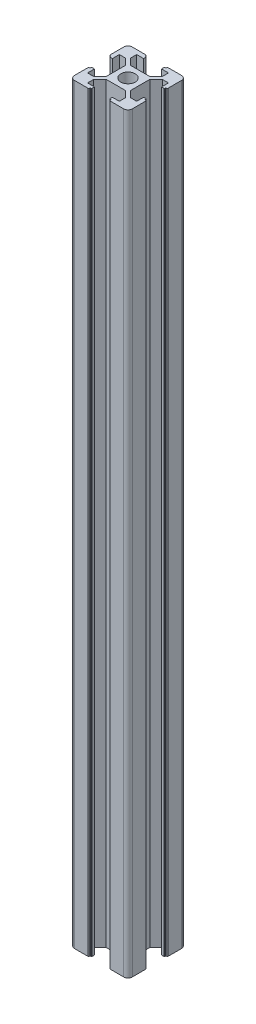
from build123d import *

# Parameters (mm, degrees)
BOSS_EXTRUDE1_DEPTH = 260
SKETCH3_R           = 2.5
CUT_EXTRUDE1_DEPTH  = 261.384331326
CIRPATTERN1_COUNT   = 4


with BuildPart() as part:
    # Sketch2 → Boss-Extrude1 (new body)
    with BuildSketch(Plane(origin=(0, 0, 0), x_dir=(1, 0, 0), z_dir=(0, 1, 0))):
        with BuildLine():
            Line((-10, -8.5), (-10, 8.5))
            ThreePointArc((-10, 8.5), (-9.560660172, 9.560660172), (-8.5, 10))
            Line((-8.5, 10), (8.5, 10))
            ThreePointArc((8.5, 10), (9.560660172, 9.560660172), (10, 8.5))
            Line((10, 8.5), (10, -8.5))
            ThreePointArc((10, -8.5), (9.560660172, -9.560660172), (8.5, -10))
            Line((8.5, -10), (-8.5, -10))
            ThreePointArc((-8.5, -10), (-9.560660172, -9.560660172), (-10, -8.5))
        make_face()
    extrude(amount=BOSS_EXTRUDE1_DEPTH)

    # Sketch3 → Cut-Extrude1 (cut, through all)
    with BuildSketch(Plane(origin=(0, 260, 0), x_dir=(1, 0, 0), z_dir=(0, 1, 0))):
        with BuildLine():
            Line((-6.348528137, -5.5), (-4.2, -3.351471863))
            Line((-4.2, -3.351471863), (-4.2, 3.351471863))
            Line((-4.2, 3.351471863), (-6.348528137, 5.5))
            Line((-6.348528137, 5.5), (-8.5, 5.5))
            Line((-8.5, 5.5), (-8.5, 3.1))
            Line((-8.5, 3.1), (-9.3, 3.1))
            ThreePointArc((-9.3, 3.1), (-9.441421356, 3.158578644), (-9.5, 3.3))
            Line((-9.5, 3.3), (-9.5, 3.6))
            Line((-9.5, 3.6), (-9.8, 3.6))
            ThreePointArc((-9.8, 3.6), (-9.941421356, 3.658578644), (-10, 3.8))
            Line((-10, 3.8), (-10, -3.8))
            ThreePointArc((-10, -3.8), (-9.941421356, -3.658578644), (-9.8, -3.6))
            Line((-9.8, -3.6), (-9.5, -3.6))
            Line((-9.5, -3.6), (-9.5, -3.3))
            ThreePointArc((-9.5, -3.3), (-9.441421356, -3.158578644), (-9.3, -3.1))
            Line((-9.3, -3.1), (-8.5, -3.1))
            Line((-8.5, -3.1), (-8.5, -5.5))
            Line((-8.5, -5.5), (-6.348528137, -5.5))
        make_face()
        Circle(SKETCH3_R)
    cut_extrude1 = extrude(amount=-CUT_EXTRUDE1_DEPTH, mode=Mode.SUBTRACT)

    # CirPattern1: Cut-Extrude1 ×4 about axis
    cirpattern1_axis = Axis((0, -20, 0), (0, 1, 0))
    for i in range(1, CIRPATTERN1_COUNT):
        add(cut_extrude1.rotate(cirpattern1_axis, i * 360 / CIRPATTERN1_COUNT), mode=Mode.SUBTRACT)


solid = part.part
